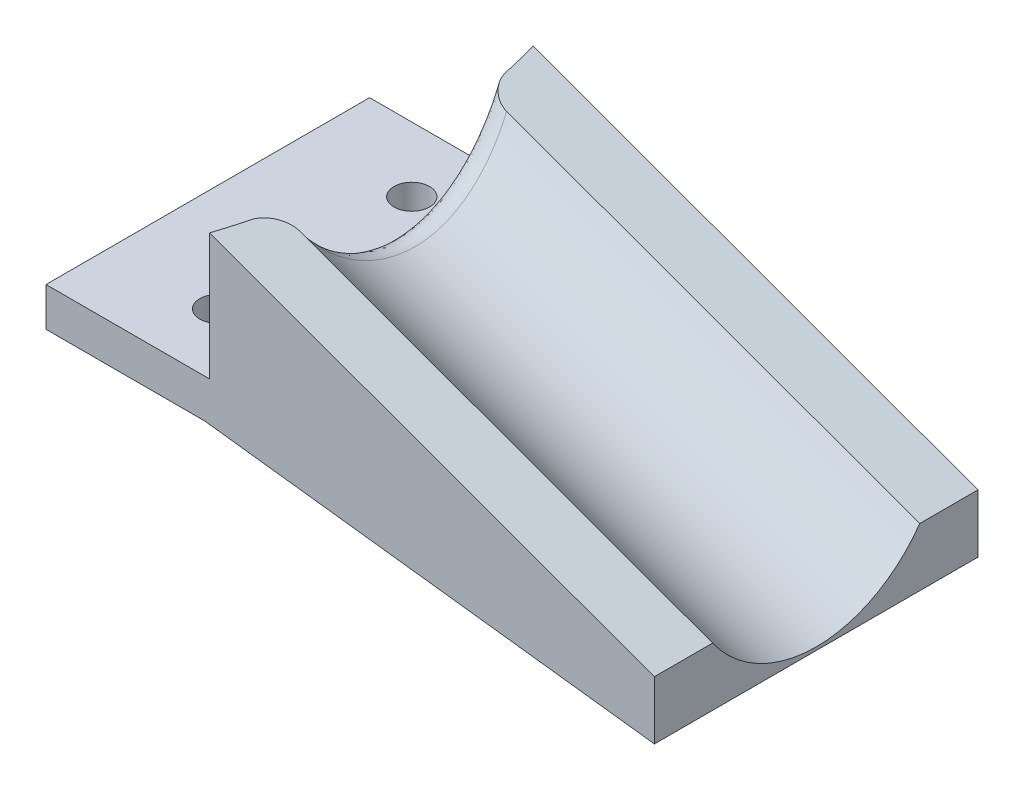
from build123d import *

# Parameters (mm, degrees)
EXTRUDE_1_DEPTH     = 50
SKETCH_4_R          = 20
CUT_EXTRUDE_1_DEPTH = 96.654466254
SKETCH_6_R          = 115.5
CUT_EXTRUDE_3_DEPTH = 20
SKETCH_8_R          = 2.75
CUT_EXTRUDE_4_DEPTH = 10
FILLET_1_R          = 3


with BuildPart() as part:
    # 草图1 → 凸台-拉伸1 (new body)
    with BuildSketch(Plane.XY):
        Polygon((-24.51528993, 0), (0, 0), (69.48471007, -8.477916399), (69.48471007, 0.522083601), (-0.51528993, 26), (-24.51528993, 26), align=None)
    extrude(amount=EXTRUDE_1_DEPTH)

    # 草图4 → 切除-拉伸1 (cut, through all)
    with BuildSketch(Plane(origin=(-8.811251384, 3.207033231, 0), x_dir=(0, 0, 1), z_dir=(-0.9396926207859082, 0.34202014332566955, 0))):
        with Locations((25, 36.255768605)):
            Circle(SKETCH_4_R)
    extrude(amount=-CUT_EXTRUDE_1_DEPTH, mode=Mode.SUBTRACT)

    # 草图6 → 切除-拉伸3 (cut)
    with BuildSketch(Plane(origin=(0, 26, 0), x_dir=(1, 0, 0), z_dir=(0, 1, 0))):
        with Locations((-112.01528993, -25)):
            Circle(SKETCH_6_R)
    extrude(amount=-CUT_EXTRUDE_3_DEPTH, mode=Mode.SUBTRACT)

    # 草图8 → 切除-拉伸4 (cut)
    with BuildSketch(Plane.XZ):
        with Locations((-8, 40)):
            Circle(SKETCH_8_R)
        with Locations((-8, 10)):
            Circle(SKETCH_8_R)
    extrude(amount=-CUT_EXTRUDE_4_DEPTH, mode=Mode.SUBTRACT)

    # 圆角1
    fillet_1_edges = [part.edges().sort_by_distance(p)[0] for p in [
        (3.48471007, 16.030696883, 25),
    ]]
    fillet(fillet_1_edges, radius=FILLET_1_R)


solid = part.part
